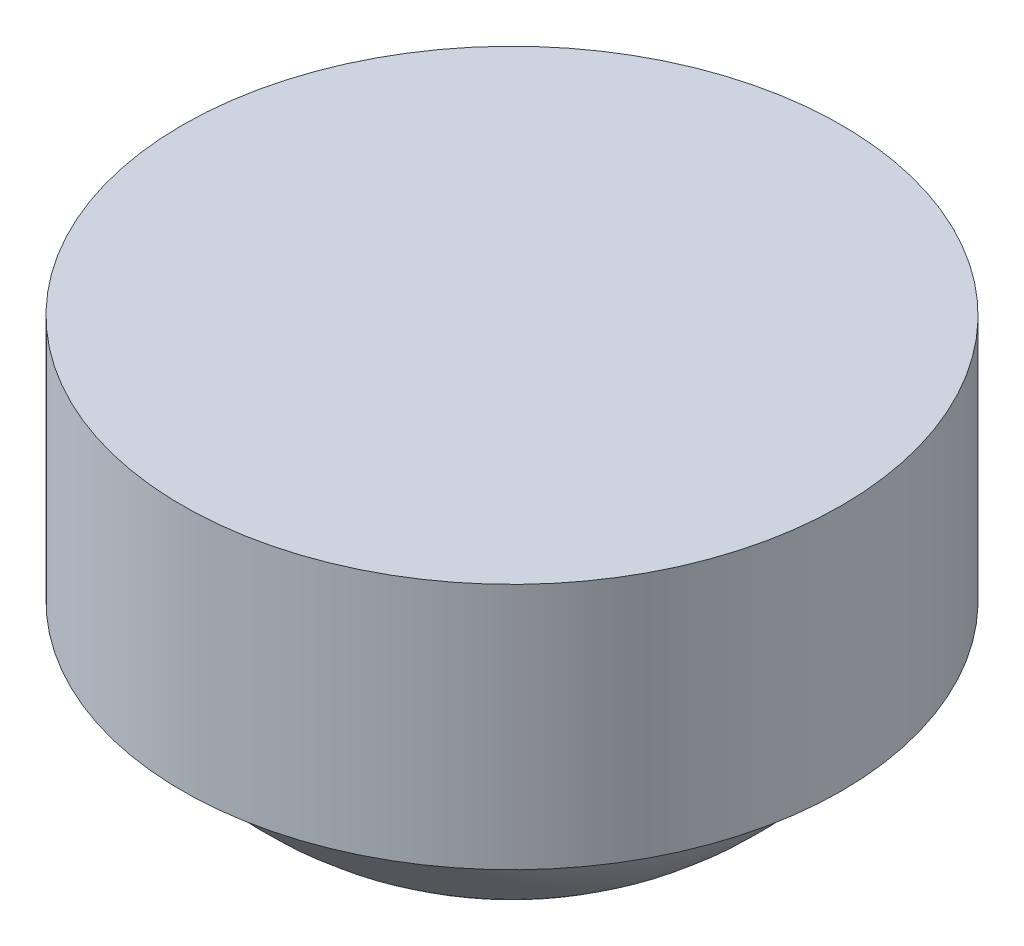
from build123d import *


with BuildPart() as part:
    # Sketch1 → Revolve1 (revolve)
    with BuildSketch(Plane.XY):
        with BuildLine():
            Line((20, -67), (0, -67))
            Line((0, -67), (0, -93))
            ThreePointArc((0, -93), (10.74709263, -90.041618553), (18.466185313, -82))
            Line((18.466185313, -82), (20, -82))
            Line((20, -82), (20, -67))
        make_face()
    revolve(axis=Axis((0, -67, 0), (0, -1, 0)))


solid = part.part
